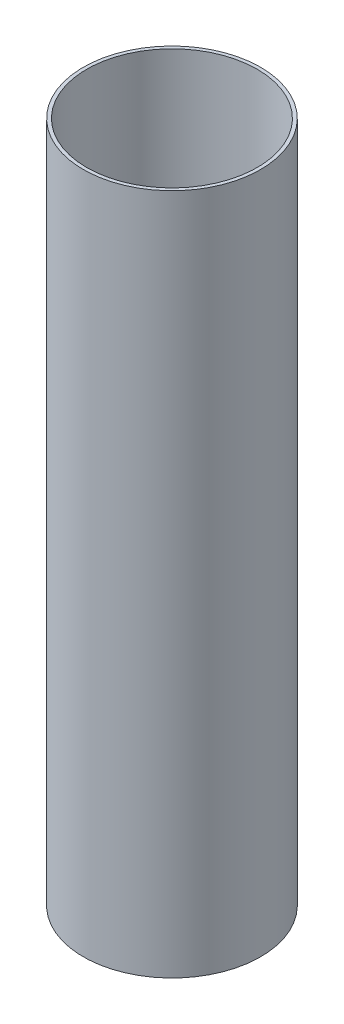
from build123d import *

# Parameters (mm, degrees)
SKETCH1_R           = 39.624
SKETCH1_R_2         = 38.1
BOSS_EXTRUDE1_DEPTH = 304.8


with BuildPart() as part:
    # Sketch1 → Boss-Extrude1 (new body)
    with BuildSketch(Plane(origin=(0, 0, 0), x_dir=(1, 0, 0), z_dir=(0, 1, 0))):
        with Locations(Location((0, 0, 0), (0, 0, 90))):
            Circle(SKETCH1_R)
        with Locations(Location((0, 0, 0), (0, 0, 90))):
            Circle(SKETCH1_R_2, mode=Mode.SUBTRACT)
    extrude(amount=BOSS_EXTRUDE1_DEPTH)


solid = part.part
